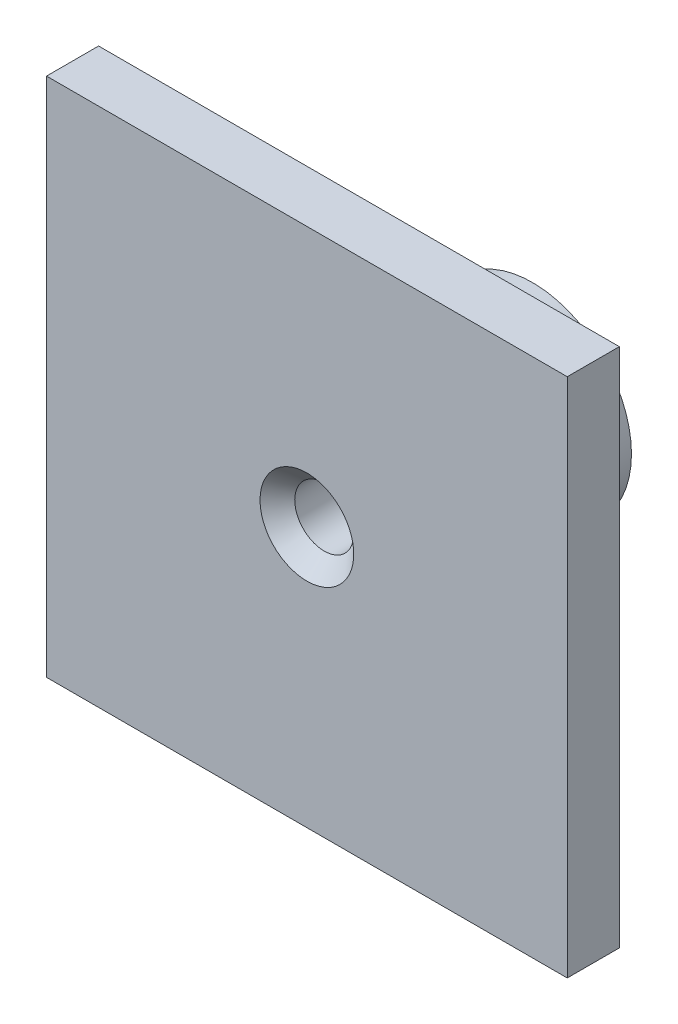
from build123d import *

# Parameters (mm, degrees)
SKETCH_2_W          = 15
SKETCH_2_H          = 15
EXTRUDE_358_DEPTH   = 1.5
SKETCH_3_R          = 2.85
SKETCH_3_R_2        = 0.85
EXTRUDE_486_DEPTH   = 5
CHAMFER_1_SIZE      = 2
SKETCH_5_R          = 0.85
CUT_EXTRUDE_2_DEPTH = 12.7260394
CHAMFER_3_SIZE      = 0.5


with BuildPart() as part:
    # Эскиз2 → Extrude 358 (new body)
    with BuildSketch(Plane.XY):
        Rectangle(SKETCH_2_W, SKETCH_2_H)
    extrude(amount=EXTRUDE_358_DEPTH)

    # Эскиз3 → Extrude 486 (add)
    with BuildSketch(Plane.XY):
        Circle(SKETCH_3_R)
        Circle(SKETCH_3_R_2, mode=Mode.SUBTRACT)
    extrude(amount=-EXTRUDE_486_DEPTH)

    # Фаска1
    chamfer_1_edges = [part.edges().sort_by_distance(p)[0] for p in [
        (-2.85, 0, 0),
    ]]
    chamfer(chamfer_1_edges, length=CHAMFER_1_SIZE)

    # Эскиз5 → Вырез-Вытянуть2 (cut, through all)
    with BuildSketch(Plane.XY):
        Circle(SKETCH_5_R)
    extrude(amount=CUT_EXTRUDE_2_DEPTH, mode=Mode.SUBTRACT)

    # Фаска3
    chamfer_3_edges = [part.edges().sort_by_distance(p)[0] for p in [
        (-0.85, 0, 1.5),
    ]]
    chamfer(chamfer_3_edges, length=CHAMFER_3_SIZE)


solid = part.part
